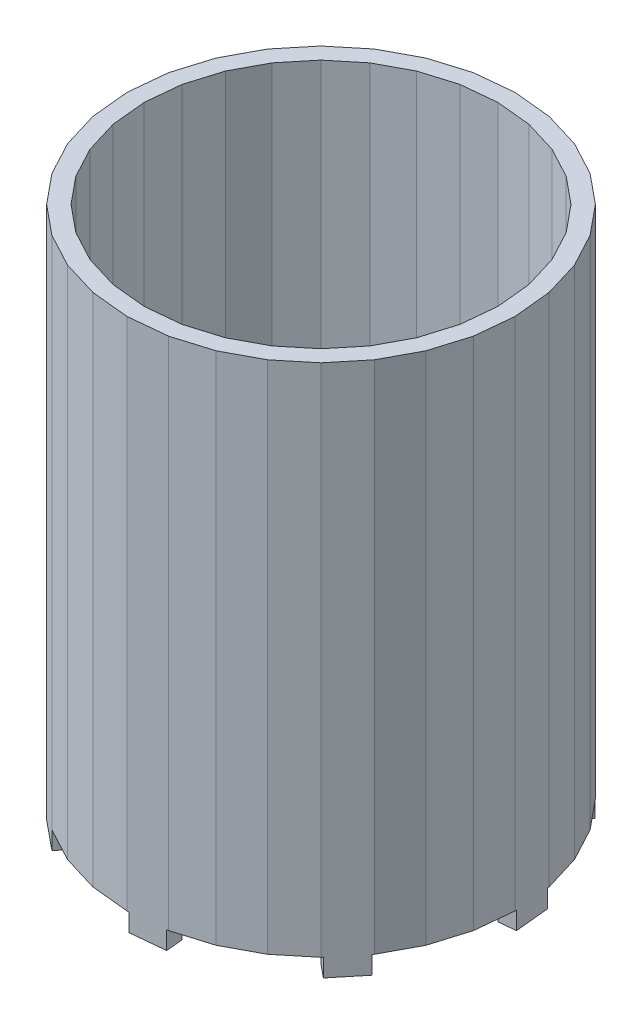
from build123d import *

# Parameters (mm, degrees)
BOSS_EXTRUDE1_DEPTH = 76.2
CUT_EXTRUDE1_DEPTH  = 173.688654555
BOSS_EXTRUDE2_DEPTH = 5.334


with BuildPart() as part:
    # Sketch4 → Boss-Extrude1 (new, symmetric)
    with BuildSketch(Plane(origin=(0, 0, 0), x_dir=(1, 0, 0), z_dir=(0, 1, 0))):
        Polygon((57.426524411, 0), (56.323089847, 11.20335914), (53.055190527, 21.976179471), (47.748409988, 31.904467549), (40.606684831, 40.606684831), (31.904467549, 47.748409988), (21.976179471, 53.055190527), (11.20335914, 56.323089847), (0, 57.426524411), (-11.20335914, 56.323089847), (-21.976179471, 53.055190527), (-31.904467549, 47.748409988), (-40.606684831, 40.606684831), (-47.748409988, 31.904467549), (-53.055190527, 21.976179471), (-56.323089847, 11.20335914), (-57.426524411, 0), (-56.323089847, -11.20335914), (-53.055190527, -21.976179471), (-47.748409988, -31.904467549), (-40.606684831, -40.606684831), (-31.904467549, -47.748409988), (-21.976179471, -53.055190527), (-11.20335914, -56.323089847), (0, -57.426524411), (11.20335914, -56.323089847), (21.976179471, -53.055190527), (31.904467549, -47.748409988), (40.606684831, -40.606684831), (47.748409988, -31.904467549), (53.055190527, -21.976179471), (56.323089847, -11.20335914), align=None)
    extrude(amount=BOSS_EXTRUDE1_DEPTH, both=True)

    # Sketch5 → Cut-Extrude1 (cut, through all)
    with BuildSketch(Plane(origin=(0, 76.2, 0), x_dir=(1, 0, 0), z_dir=(0, 1, 0))):
        Polygon((51.316592972, -10.207504994), (52.321944464, 0), (51.316592972, 10.207504994), (48.339173591, 20.022741295), (43.504106878, 29.068514878), (36.997201735, 36.997201735), (29.068514878, 43.504106878), (20.022741295, 48.339173591), (10.207504994, 51.316592972), (0, 52.321944464), (-10.207504994, 51.316592972), (-20.022741295, 48.339173591), (-29.068514878, 43.504106878), (-36.997201735, 36.997201735), (-43.504106878, 29.068514878), (-48.339173591, 20.022741295), (-51.316592972, 10.207504994), (-52.321944464, 0), (-51.316592972, -10.207504994), (-48.339173591, -20.022741295), (-43.504106878, -29.068514878), (-36.997201735, -36.997201735), (-29.068514878, -43.504106878), (-20.022741295, -48.339173591), (-10.207504994, -51.316592972), (0, -52.321944464), (10.207504994, -51.316592972), (20.022741295, -48.339173591), (29.068514878, -43.504106878), (36.997201735, -36.997201735), (43.504106878, -29.068514878), (48.339173591, -20.022741295), align=None)
    extrude(amount=-CUT_EXTRUDE1_DEPTH, mode=Mode.SUBTRACT)

    # Sketch6 → Boss-Extrude2 (add)
    with BuildSketch(Plane.XZ.offset(76.2)):
        Polygon((-51.316592972, 10.207504994), (-52.321944464, 0), (-57.377482875, 0.497927073), (-56.372131384, 10.705432067), align=None)
        Polygon((57.377482875, -0.497927073), (56.372131384, -10.705432067), (51.316592972, -10.207504994), (52.321944464, 0), align=None)
        Polygon((-47.748409988, -31.904467549), (-40.606684831, -40.606684831), (-36.679791728, -37.383966948), (-43.821516885, -28.681749665), align=None)
        Polygon((36.997201735, -36.997201735), (29.068514878, -43.504106878), (32.291232761, -47.430999981), (40.219919619, -40.924094838), align=None)
        Polygon((47.430999981, 32.291232761), (40.924094838, 40.219919619), (36.997201735, 36.997201735), (43.504106878, 29.068514878), align=None)
        Polygon((-37.383966948, 36.679791728), (-28.681749665, 43.821516885), (-31.904467549, 47.748409988), (-40.606684831, 40.606684831), align=None)
        Polygon((0, 52.321944464), (10.207504994, 51.316592972), (10.705432067, 56.372131384), (0.497927073, 57.377482875), align=None)
        Polygon((-10.705432067, -56.372131384), (-0.497927073, -57.377482875), (0, -52.321944464), (-10.207504994, -51.316592972), align=None)
    extrude(amount=BOSS_EXTRUDE2_DEPTH)


solid = part.part
